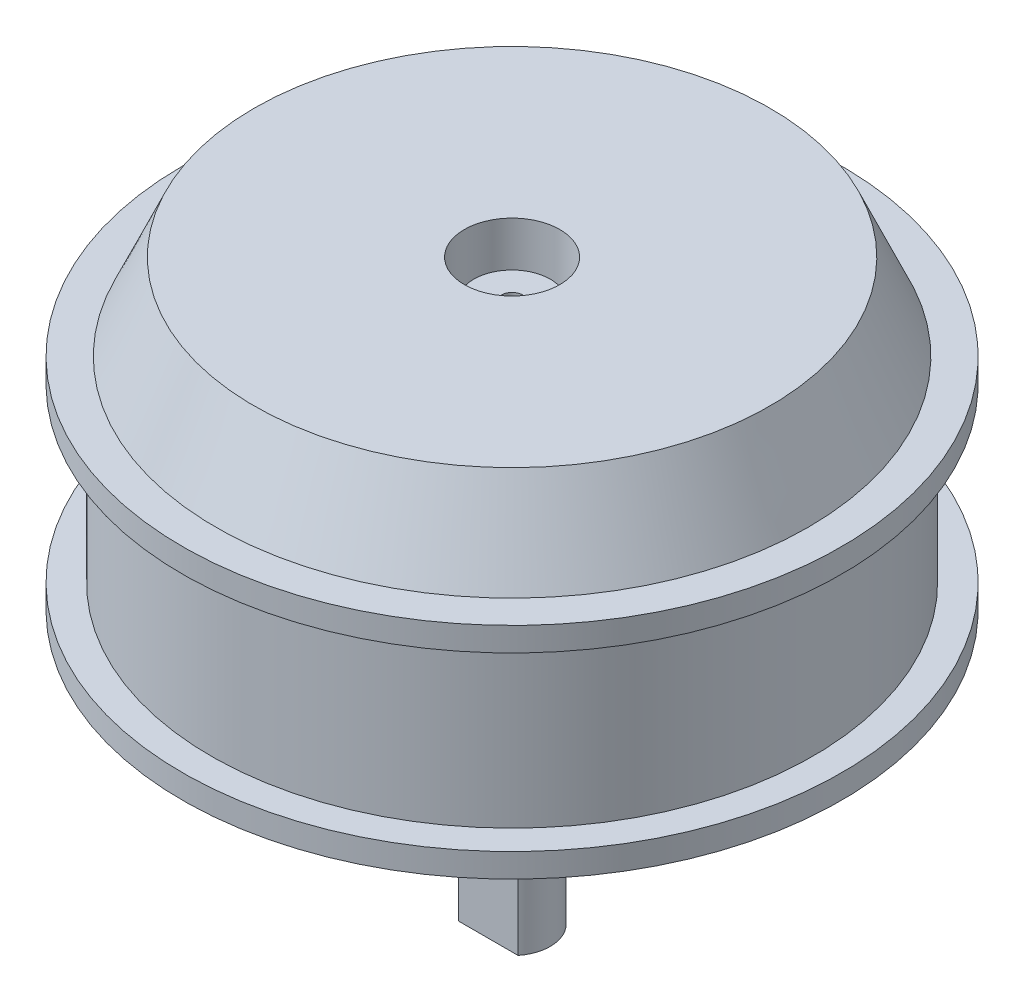
from build123d import *

# Parameters (mm, degrees)
EXTRUDE_START            = 53
SKETCH_3_R               = 8
EXTRUDE_1_DEPTH          = 53
SKETCH_4_W               = 21.869380784
SKETCH_4_H               = 6.809627549
CUT_EXTRUDE_1_DEPTH      = 46
SKETCH_5_R               = 3.5
CUT_EXTRUDE_2_DEPTH      = 70
PATTERN_CIRCULAR_1_COUNT = 6
HOLE_WIZARD_M41_D        = 4.5
HOLE_WIZARD_M41_DEPTH    = 14
HOLE_WIZARD_M41_TIP      = 1.351936393
SKETCH_14_R              = 9.95061624
SKETCH_14_R_2            = 8
CUT_EXTRUDE_5_DEPTH      = 10


with BuildPart() as part:
    # Эскиз2 → Повернуть1 (revolve)
    with BuildSketch(Plane.XY):
        Polygon((-10, 0), (-54, 0), (-62, -18), (-69, -18), (-69, -23), (-63, -23), (-63, -59), (-69, -59), (-69, -64), (-23, -64), (-14, -68), (0, -68), (0, -8), (-8, -8), (-8, -11.730591033), (-10, -11.730591033), align=None)
    revolve(axis=Axis((0, -8, 0), (0, -1, 0)))

    # Эскиз3 → Бобышка-Вытянуть1 (add)
    with BuildSketch(Plane.XZ.offset(68).offset(EXTRUDE_START)):
        with Locations(Location((0, 0, 0), (0, 0, 180))):
            Circle(SKETCH_3_R)
    extrude(amount=-EXTRUDE_1_DEPTH)

    # Эскиз4 → Вырез-Вытянуть1 (cut)
    with BuildSketch(Plane.XZ.offset(121)):
        with Locations((-0.065477188, 8.404813774)):
            Rectangle(SKETCH_4_W, SKETCH_4_H)
    extrude(amount=-CUT_EXTRUDE_1_DEPTH, mode=Mode.SUBTRACT)

    # Эскиз5 → Вырез-Вытянуть2 (cut)
    with BuildSketch(Plane.XZ.offset(121)):
        with Locations(Location((0, 0, 0), (0, 0, 270))):
            Circle(SKETCH_5_R)
    extrude(amount=-CUT_EXTRUDE_2_DEPTH, mode=Mode.SUBTRACT)

    # Эскиз7 → Зенковка для винта с полупотайной головкой M51 (revolve, cut)
    with BuildSketch(Plane(origin=(-1.157683247, -64, -60), x_dir=(0, 0, -1), z_dir=(1, 0, 0))):
        Polygon((0, 0), (0, 15.652366702), (2.75, 14), (2.75, 2.45), (5.2, 0), align=None)
    hole_wizard_m51 = revolve(axis=Axis((-1.157683247, -70.35, -60), (0, 1, 0)), mode=Mode.SUBTRACT)

    # Круговой массив1: Зенковка для винта с полупотайной головкой M51 ×6 about axis
    pattern_circular_1_axis = Axis((0, 0, 0), (0, 1, 0))
    for i in range(1, PATTERN_CIRCULAR_1_COUNT):
        add(hole_wizard_m51.rotate(pattern_circular_1_axis, i * 360 / PATTERN_CIRCULAR_1_COUNT), mode=Mode.SUBTRACT)

    # Отверстие с зазором M41
    with Locations(Plane(origin=(0, -8, 0), x_dir=(1, 0, 0), z_dir=(0, 1, 0))):
        with Locations((0, 0)):
            Hole(HOLE_WIZARD_M41_D / 2, depth=HOLE_WIZARD_M41_DEPTH)
            with Locations((0, 0, -(HOLE_WIZARD_M41_DEPTH + HOLE_WIZARD_M41_TIP / 2))):  # 118° drill point
                Cone(0, HOLE_WIZARD_M41_D / 2, HOLE_WIZARD_M41_TIP, mode=Mode.SUBTRACT)

    # Эскиз14 → Вырез-Вытянуть5 (cut)
    with BuildSketch(Plane.XZ.offset(68)):
        Circle(SKETCH_14_R)
        with Locations(Location((0, 0, 0), (0, 0, 180))):
            Circle(SKETCH_14_R_2, mode=Mode.SUBTRACT)
    extrude(amount=-CUT_EXTRUDE_5_DEPTH, mode=Mode.SUBTRACT)


solid = part.part
